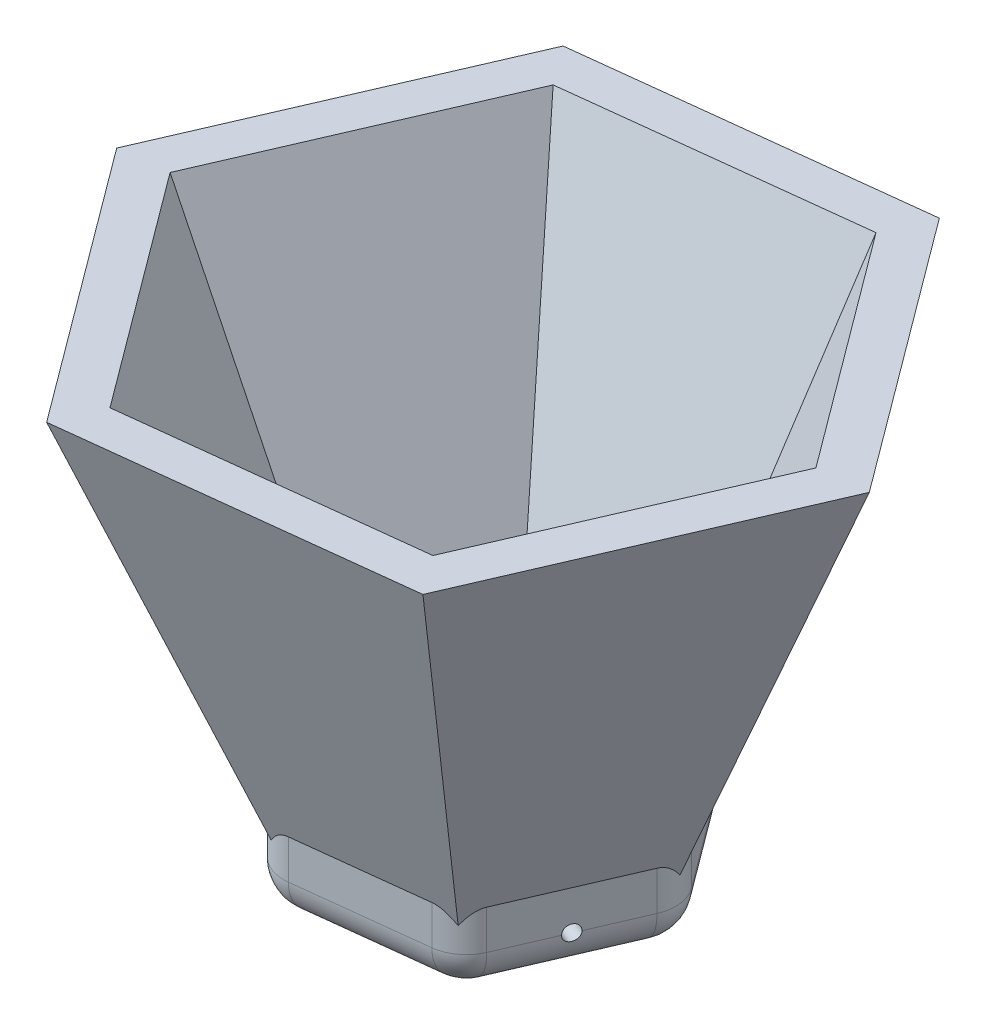
from build123d import *

# Parameters (mm, degrees)
BOSS_EXTRUDE1_DEPTH = 50
BOSS_EXTRUDE1_DRAFT = -20
SHELL3_T            = -5
BOSS_EXTRUDE3_DEPTH = 10
FILLET2_R           = 5
SKETCH12_R          = 1
CUT_EXTRUDE1_DEPTH  = 98.648600839


with BuildPart() as part:
    # Sketch3 → Boss-Extrude1 (with draft: the straight prism first)
    with BuildSketch(Plane(origin=(0, 0, 0), x_dir=(1, 0, 0), z_dir=(0, 1, 0))):
        Polygon((43.013605704, 4.982943342), (17.191447333, 39.742346919), (-25.822158371, 34.759403577), (-43.013605704, -4.982943342), (-17.191447333, -39.742346919), (25.822158371, -34.759403577), align=None)
    extrude(amount=-BOSS_EXTRUDE1_DEPTH)
    # Boss-Extrude1: the draft: its side faces are tilted about the plane it starts from
    boss_extrude1_sides = [part.faces().sort_by_distance(p)[0] for p in [
        (30.102526518, -25, -22.36264513),
        (-4.315355519, -25, -37.250875248),
        (-34.417882038, -25, -14.888230118),
        (-30.102526518, -25, 22.36264513),
        (4.315355519, -25, 37.250875248),
        (34.417882038, -25, 14.888230118),
    ]]
    draft(boss_extrude1_sides, Plane(origin=(0, 0, 0), x_dir=(1, 0, 0), z_dir=(0, 1, 0)), BOSS_EXTRUDE1_DRAFT)

    # Shell3
    shell3_openings = [part.faces().sort_by_distance(p)[0] for p in [
        (0, 0, 0),
    ]]
    offset(amount=SHELL3_T, openings=shell3_openings, kind=Kind.INTERSECTION)

    # Sketch11 → Boss-Extrude3 (add)
    with BuildSketch(Plane.XZ.offset(50)):
        Polygon((13.290828996, 17.890885893), (-8.848547182, 20.455638494), (-22.139376178, 2.564752601), (-13.290828996, -17.890885893), (8.848547182, -20.455638494), (22.139376178, -2.564752601), align=None)
    extrude(amount=BOSS_EXTRUDE3_DEPTH)

    # Fillet2
    fillet2_edges = [part.edges().sort_by_distance(p)[0] for p in [
        (22.139376178, -55, -2.564752601),
        (13.290828996, -55, 17.890885893),
        (-8.848547182, -55, 20.455638494),
        (-22.139376178, -55, 2.564752601),
        (-13.290828996, -55, -17.890885893),
        (8.848547182, -55, -20.455638494),
        (17.715102587, -60, 7.663066646),
        (2.221140907, -60, 19.173262194),
        (-15.49396168, -60, 11.510195548),
        (-17.715102587, -60, -7.663066646),
        (-2.221140907, -60, -19.173262194),
        (15.49396168, -60, -11.510195548),
    ]]
    fillet(fillet2_edges, radius=FILLET2_R)

    # Sketch12 → Cut-Extrude1 (cut, through all)
    with BuildSketch(Plane(origin=(-17.715102587, 0, -7.663066646), x_dir=(-0.39701946980837655, 0, 0.9178101876712176), z_dir=(-0.9178101876712177, 0, -0.3970194698083766))):
        with Locations((0, -55)):
            Circle(SKETCH12_R)
    extrude(amount=-CUT_EXTRUDE1_DEPTH, mode=Mode.SUBTRACT)


solid = part.part
